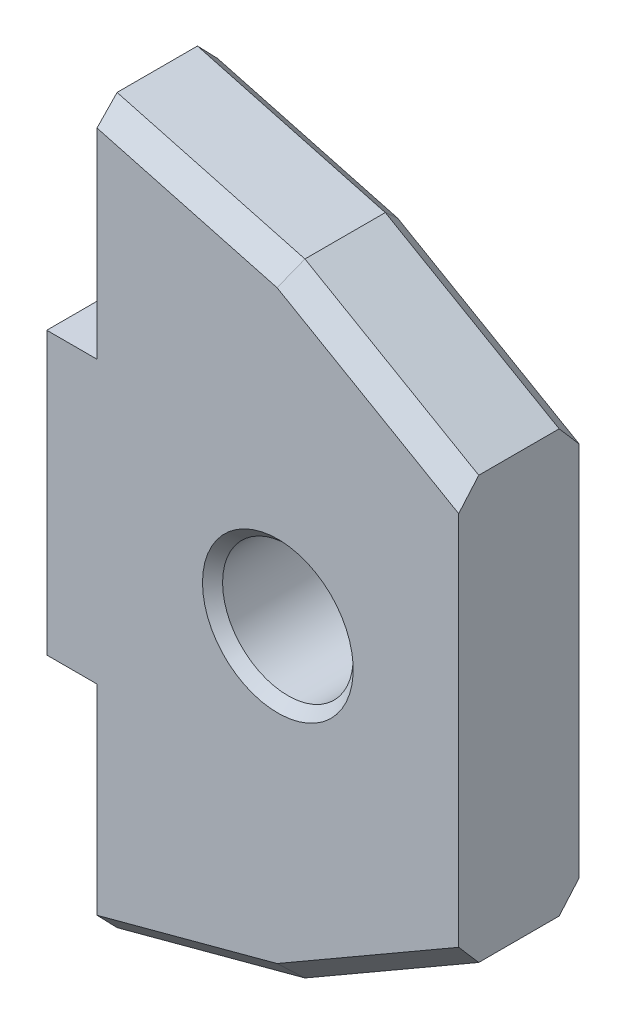
from build123d import *

# Parameters (mm, degrees)
SKETCH_1_R      = 6.5
EXTRUDE_1_DEPTH = 6
CHAMFER_1_SIZE  = 2
CHAMFER_2_SIZE  = 1


with BuildPart() as part:
    # 草图1 → 凸台-拉伸1 (new, symmetric)
    with BuildSketch(Plane.XY):
        Polygon((-23, -14), (-23, 14), (-18, 14), (-18, 36), (0.696152423, 30.990381057), (18, 21), (18, -21), (0.696152423, -30.990381057), (-18, -36), (-18, -14), align=None)
        with Locations(Location((0, 0, 0), (0, 0, 180))):
            Circle(SKETCH_1_R, mode=Mode.SUBTRACT)
    extrude(amount=EXTRUDE_1_DEPTH, both=True)

    # 倒角1
    chamfer_1_edges = [part.edges().sort_by_distance(p)[0] for p in [
        (-8.651923789, -33.495190528, -6),
        (9.348076211, -25.995190528, -6),
        (9.348076211, 25.995190528, 6),
        (9.348076211, 25.995190528, -6),
        (-8.651923789, 33.495190528, -6),
        (9.348076211, -25.995190528, 6),
        (-8.651923789, -33.495190528, 6),
        (-8.651923789, 33.495190528, 6),
    ]]
    chamfer(chamfer_1_edges, length=CHAMFER_1_SIZE)

    # 倒角2
    chamfer_2_edges = [part.edges().sort_by_distance(p)[0] for p in [
        (6.5, 0, 6),
        (6.5, 0, -6),
    ]]
    chamfer(chamfer_2_edges, length=CHAMFER_2_SIZE)


solid = part.part
